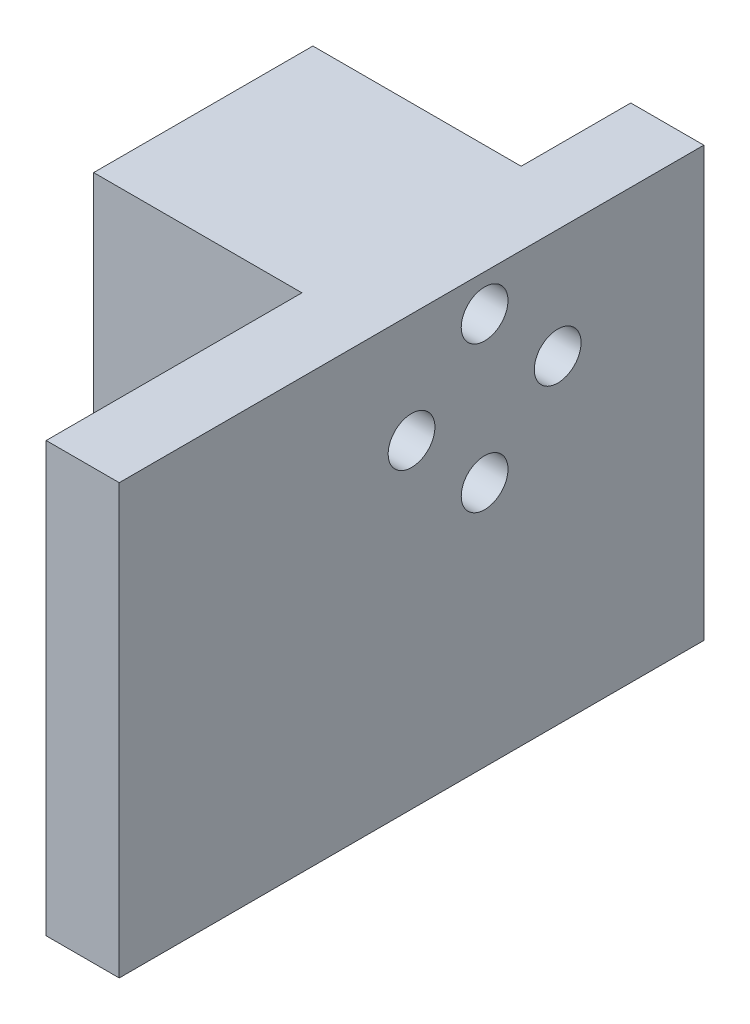
from build123d import *

# Parameters (mm, degrees)
BOSS_EXTRUDE1_DEPTH     = 5
CUT_EXTRUDE1_DEPTH      = 114.468057179
CUT_EXTRUDE1_DEPTH_BACK = 114.468057179
SKETCH3_R               = 1.6
SKETCH4_R               = 2.55
CUT_EXTRUDE2_DEPTH      = 10
SKETCH5_R               = 1.55
CUT_EXTRUDE3_DEPTH      = 114.468057179
SKETCH6_R               = 1.55
CUT_EXTRUDE4_DEPTH      = 114.468057179
SKETCH7_W               = 23
SKETCH7_H               = 110
BOSS_EXTRUDE2_DEPTH     = 5
SKETCH9_W               = 5
SKETCH9_H               = 40
BOSS_EXTRUDE4_DEPTH     = 33
SKETCH11_W              = 12
SKETCH11_H              = 12
CUT_EXTRUDE5_DEPTH      = 50
SKETCH12_R              = 1.6
CUT_EXTRUDE6_DEPTH      = 50
BOSS_EXTRUDE5_START     = 14.25
SKETCH13_W              = 15
SKETCH13_H              = 15
SKETCH13_R              = 1.6
BOSS_EXTRUDE5_DEPTH     = 14.25
SKETCH15_W              = 89.5
SKETCH15_H              = 3.65
CUT_EXTRUDE9_DEPTH      = 153.144667997
SKETCH18_W              = 13
SKETCH18_H              = 110
CUT_EXTRUDE10_DEPTH     = 134.005347637
FILLET5_R               = 5
SKETCH19_R              = 1.55
CUT_EXTRUDE11_DEPTH     = 5
CUT_EXTRUDE12_DEPTH     = 189.758900452


with BuildPart() as part:
    # Sketch1 → Boss-Extrude1 (new body)
    with BuildSketch(Plane(origin=(0, 0, 0), x_dir=(1, 0, 0), z_dir=(0, 1, 0))):
        Polygon((75, 85), (-75, 85), (-75, -25), (-45, -45), (-45, -80), (45, -80), (45, -45), (75, -25), align=None)
        Polygon((-18.5, -10), (-18.5, 10), (-7.5, 10), (-7.5, 50), (7.5, 50), (7.5, 10), (18.5, 10), (18.5, -10), align=None, mode=Mode.SUBTRACT)
    extrude(amount=BOSS_EXTRUDE1_DEPTH)

    # Sketch3 → Cut-Extrude1 (cut, two sides: drawn at the far end of the back side and taken through both)
    with BuildSketch(Plane(origin=(0, 5, 0), x_dir=(1, 0, 0), z_dir=(0, 1, 0)).offset(-CUT_EXTRUDE1_DEPTH_BACK)):
        with Locations((-35, 20)):
            Circle(SKETCH3_R)
        with Locations((-35, -20)):
            Circle(SKETCH3_R)
        with Locations((35, -20)):
            Circle(SKETCH3_R)
        with Locations((35, 20)):
            Circle(SKETCH3_R)
    extrude(amount=CUT_EXTRUDE1_DEPTH + CUT_EXTRUDE1_DEPTH_BACK, mode=Mode.SUBTRACT)

    # Sketch4 → Cut-Extrude2 (cut)
    with BuildSketch(Plane(origin=(0, 5, 0), x_dir=(1, 0, 0), z_dir=(0, 1, 0))):
        with Locations((-65, 66)):
            Circle(SKETCH4_R)
        with Locations((-65, -4)):
            Circle(SKETCH4_R)
        with Locations((65, 66)):
            Circle(SKETCH4_R)
        with Locations((65, -4)):
            Circle(SKETCH4_R)
    extrude(amount=-CUT_EXTRUDE2_DEPTH, mode=Mode.SUBTRACT)

    # Sketch5 → Cut-Extrude3 (cut, through all)
    with BuildSketch(Plane(origin=(0, 5, 0), x_dir=(1, 0, 0), z_dir=(0, 1, 0))):
        with Locations((-39, -75)):
            Circle(SKETCH5_R)
        with Locations((39, -75)):
            Circle(SKETCH5_R)
        with Locations((-39, -50)):
            Circle(SKETCH5_R)
        with Locations((39, -50)):
            Circle(SKETCH5_R)
    extrude(amount=-CUT_EXTRUDE3_DEPTH, mode=Mode.SUBTRACT)

    # Sketch6 → Cut-Extrude4 (cut, through all)
    with BuildSketch(Plane(origin=(0, 5, 0), x_dir=(1, 0, 0), z_dir=(0, 1, 0))):
        with Locations((62.5, 80)):
            Circle(SKETCH6_R)
        with Locations((-62.5, 80)):
            Circle(SKETCH6_R)
    extrude(amount=-CUT_EXTRUDE4_DEPTH, mode=Mode.SUBTRACT)

    # Sketch7 → Boss-Extrude2 (add)
    with BuildSketch(Plane(origin=(0, 5, 0), x_dir=(1, 0, 0), z_dir=(0, 1, 0))):
        with Locations((-86.5, 30)):
            Rectangle(SKETCH7_W, SKETCH7_H)
        with Locations((86.5, 30)):
            Rectangle(SKETCH7_W, SKETCH7_H)
    extrude(amount=-BOSS_EXTRUDE2_DEPTH)

    # Sketch9 → Boss-Extrude4 (add)
    with BuildSketch(Plane(origin=(0, 5, 0), x_dir=(1, 0, 0), z_dir=(0, 1, 0))):
        with Locations((-42.25, -5)):
            Rectangle(SKETCH9_W, SKETCH9_H)
        with Locations((42.25, -5)):
            Rectangle(SKETCH9_W, SKETCH9_H)
    extrude(amount=BOSS_EXTRUDE4_DEPTH)

    # Sketch11 → Cut-Extrude5 (cut)
    with BuildSketch(Plane(origin=(0, 5, 0), x_dir=(1, 0, 0), z_dir=(0, 1, 0))):
        with Locations((-67, 18.305755671)):
            Rectangle(SKETCH11_W, SKETCH11_H)
        with Locations((67, 18.305755671)):
            Rectangle(SKETCH11_W, SKETCH11_H)
    extrude(amount=-CUT_EXTRUDE5_DEPTH, mode=Mode.SUBTRACT)

    # Sketch12 → Cut-Extrude6 (cut)
    with BuildSketch(Plane.ZY.offset(44.75)):
        with Locations((0, 31.85)):
            Circle(SKETCH12_R)
        with Locations((5, 26.85)):
            Circle(SKETCH12_R)
        with Locations((0, 21.85)):
            Circle(SKETCH12_R)
        with Locations((-5, 26.85)):
            Circle(SKETCH12_R)
    cut_extrude6 = extrude(amount=-CUT_EXTRUDE6_DEPTH, mode=Mode.SUBTRACT)

    # Sketch13 → Boss-Extrude5 (add)
    with BuildSketch(Plane.ZY.offset(44.75).offset(BOSS_EXTRUDE5_START)):
        with Locations((0, 26.85)):
            Rectangle(SKETCH13_W, SKETCH13_H)
        with Locations((0, 31.85)):
            Circle(SKETCH13_R, mode=Mode.SUBTRACT)
        with Locations((5, 26.85)):
            Circle(SKETCH13_R, mode=Mode.SUBTRACT)
        with Locations((-5, 26.85)):
            Circle(SKETCH13_R, mode=Mode.SUBTRACT)
        with Locations((0, 21.85)):
            Circle(SKETCH13_R, mode=Mode.SUBTRACT)
    boss_extrude5 = extrude(amount=-BOSS_EXTRUDE5_DEPTH)

    # Mirror2: Cut-Extrude6 across plane
    add(cut_extrude6.mirror(Plane.ZY), mode=Mode.SUBTRACT)

    # Mirror3: Boss-Extrude5 across plane
    add(boss_extrude5.mirror(Plane.ZY))

    # Sketch15 → Cut-Extrude9 (cut, through all)
    with BuildSketch(Plane.XY.offset(25)):
        with Locations((0, 36.175)):
            Rectangle(SKETCH15_W, SKETCH15_H)
    extrude(amount=-CUT_EXTRUDE9_DEPTH, mode=Mode.SUBTRACT)

    # Sketch18 → Cut-Extrude10 (cut, through all)
    with BuildSketch(Plane(origin=(0, 5, 0), x_dir=(1, 0, 0), z_dir=(0, 1, 0))):
        with Locations((-91.5, 30)):
            Rectangle(SKETCH18_W, SKETCH18_H)
        with Locations((91.5, 30)):
            Rectangle(SKETCH18_W, SKETCH18_H)
    extrude(amount=-CUT_EXTRUDE10_DEPTH, mode=Mode.SUBTRACT)

    # Fillet5
    fillet5_edges = [part.edges().sort_by_distance(p)[0] for p in [
        (44.75, 19.35, 0),
        (-44.75, 19.35, 0),
    ]]
    fillet(fillet5_edges, radius=FILLET5_R)

    # Sketch19 → Cut-Extrude11 (cut)
    with BuildSketch(Plane(origin=(0, 5, 0), x_dir=(1, 0, 0), z_dir=(0, 1, 0))):
        with Locations((55, 34.5)):
            Circle(SKETCH19_R)
        with Locations((25, 34.5)):
            Circle(SKETCH19_R)
        with Locations((25, 44.5)):
            Circle(SKETCH19_R)
        with Locations((55, 44.5)):
            Circle(SKETCH19_R)
    cut_extrude11 = extrude(amount=-CUT_EXTRUDE11_DEPTH, mode=Mode.SUBTRACT)

    # Mirror4: Cut-Extrude11 across plane
    add(cut_extrude11.mirror(Plane.ZY), mode=Mode.SUBTRACT)

    # Sketch21 → Cut-Extrude12 (cut, through all)
    with BuildSketch(Plane.XY.offset(80)):
        Polygon((-85, 5), (-85, 0), (85, 0), (85, 5), (59, 5), (59, 34.35), (39.75, 34.35), (39.75, 5), align=None)
    extrude(amount=-CUT_EXTRUDE12_DEPTH, mode=Mode.SUBTRACT)


solid = part.part
